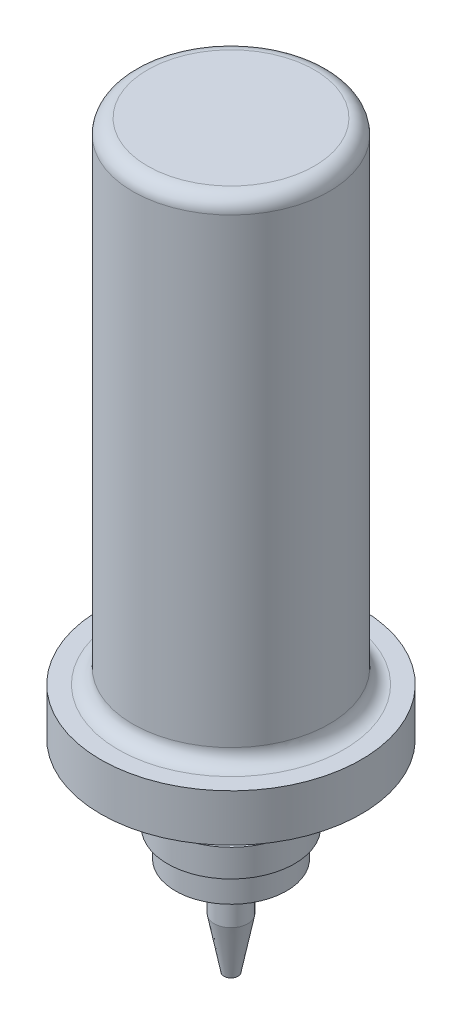
from build123d import *

# Parameters (mm, degrees)
SKETCH1_R           = 10.00174333
BOSS_EXTRUDE3_DEPTH = 50
SKETCH4_R           = 13.27917762
BOSS_EXTRUDE4_DEPTH = 4.8
FILLET1_R           = 1.5
SKETCH5_R           = 5.290974817
BOSS_EXTRUDE5_DEPTH = 5
SKETCH6_R           = 6.466211651
BOSS_EXTRUDE6_DEPTH = 2.8
SKETCH7_R           = 5.659284008
BOSS_EXTRUDE7_DEPTH = 2.8
SKETCH8_R           = 1.715557864
BOSS_EXTRUDE8_DEPTH = 10
CHAMFER1_SIZE       = 1
CHAMFER1_SIZE2      = 5.144554016


with BuildPart() as part:
    # Sketch1 → Boss-Extrude3 (new body)
    with BuildSketch(Plane(origin=(0, 0, 0), x_dir=(1, 0, 0), z_dir=(0, 1, 0))):
        with Locations(Location((0, 0, 0), (0, 0, 270))):
            Circle(SKETCH1_R)
    extrude(amount=-BOSS_EXTRUDE3_DEPTH)

    # Sketch4 → Boss-Extrude4 (add)
    with BuildSketch(Plane.XZ.offset(50)):
        with Locations(Location((0, 0, 0), (0, 0, 270))):
            Circle(SKETCH4_R)
    extrude(amount=BOSS_EXTRUDE4_DEPTH)

    # Fillet1
    fillet1_edges = [part.edges().sort_by_distance(p)[0] for p in [
        (0, 0, -10.00174333),
        (0, -50, -10.00174333),
    ]]
    fillet(fillet1_edges, radius=FILLET1_R)

    # Sketch5 → Boss-Extrude5 (add)
    with BuildSketch(Plane(origin=(0, -54.8, 0), x_dir=(-1, 0, 0), z_dir=(0, -1, 0))):
        with Locations(Location((0, 0, 0), (0, 0, 90))):
            Circle(SKETCH5_R)
    extrude(amount=BOSS_EXTRUDE5_DEPTH)

    # Sketch6 → Boss-Extrude6 (add)
    with BuildSketch(Plane(origin=(0, -59.8, 0), x_dir=(-1, 0, 0), z_dir=(0, -1, 0))):
        with Locations(Location((0, 0, 0), (0, 0, 90))):
            Circle(SKETCH6_R)
    extrude(amount=BOSS_EXTRUDE6_DEPTH)

    # Sketch7 → Boss-Extrude7 (add)
    with BuildSketch(Plane(origin=(0, -62.6, 0), x_dir=(-1, 0, 0), z_dir=(0, -1, 0))):
        with Locations(Location((0, 0, 0), (0, 0, 90))):
            Circle(SKETCH7_R)
    extrude(amount=BOSS_EXTRUDE7_DEPTH)

    # Sketch8 → Boss-Extrude8 (add)
    with BuildSketch(Plane.XZ.offset(65.4)):
        with Locations(Location((0, 0, 0), (0, 0, 270))):
            Circle(SKETCH8_R)
    extrude(amount=BOSS_EXTRUDE8_DEPTH)

    # Chamfer1
    chamfer1_edges = [part.edges().sort_by_distance(p)[0] for p in [
        (0, -75.4, 1.715557864),
    ]]
    chamfer1_side = [part.faces().sort_by_distance(p)[0] for p in [
        (0, -75.4, 0),
    ]]
    chamfer(chamfer1_edges, length=CHAMFER1_SIZE, length2=CHAMFER1_SIZE2, reference=chamfer1_side[0])


solid = part.part
